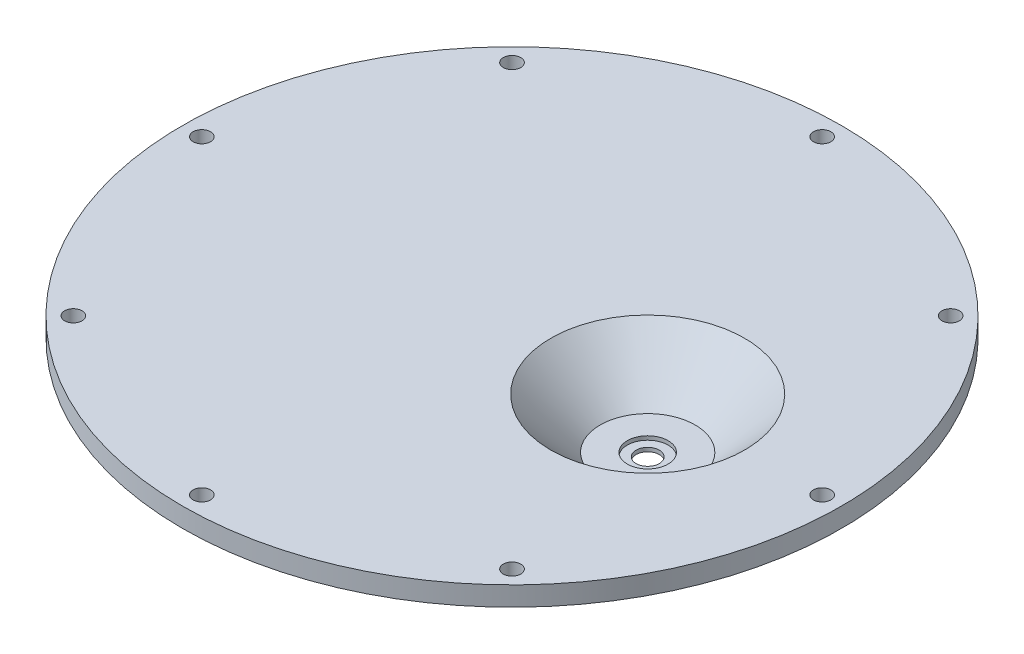
from build123d import *

# Parameters (mm, degrees)
EXTRUDE_START      = -5
SKETCH_6_R         = 85
SKETCH_6_R_2       = 25
EXTRUDE_1041_DEPTH = 5
HOLE_WIZARD_M4_8_D = 4.5


with BuildPart() as part:
    # 草图2 → Revolve 925 (revolve)
    with BuildSketch(Plane.XY, mode=Mode.PRIVATE) as revolve_925_sk:
        Polygon((32, -15), (32, -14), (29.75, -14), (29.75, -13), (22.75, -13), (10, 0), (10, -5), (23, -15), align=None)
    revolve(revolve_925_sk.sketch.rotate(Axis((35, 1.713666668, 0), (0, -1, 0)), 270), axis=Axis((35, 1.713666668, 0), (0, -1, 0)))

    # 草图6 → Extrude 1041 (add)
    with BuildSketch(Plane(origin=(0, 0, 0), x_dir=(1, 0, 0), z_dir=(0, 1, 0)).offset(EXTRUDE_START)):
        with Locations(Location((0, 0, 0), (0, 0, 270))):
            Circle(SKETCH_6_R)
        with Locations((35, 0)):
            Circle(SKETCH_6_R_2, mode=Mode.SUBTRACT)
    extrude(amount=EXTRUDE_1041_DEPTH)

    # M4*8 固定孔 (through all)
    with Locations(Plane(origin=(0, 0, 0), x_dir=(1, 0, 0), z_dir=(0, 1, 0))):
        with Locations((80, 0), (-80, 0), (-56.568542495, 56.568542495), (0, 80), (56.568542495, -56.568542495), (0, -80), (-56.568542495, -56.568542495), (56.568542495, 56.568542495)):
            Hole(HOLE_WIZARD_M4_8_D / 2)


solid = part.part
